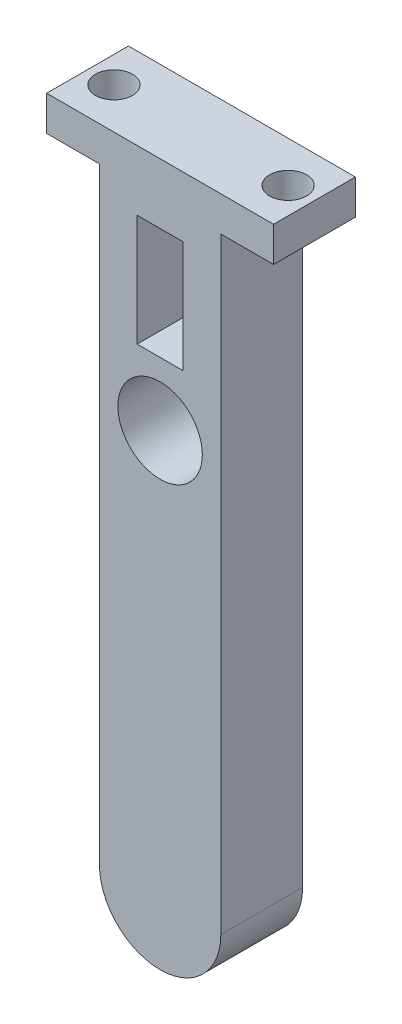
from build123d import *

# Parameters (mm, degrees)
ESTRUSIONE_ESTRUSIONE3_DEPTH = 15.5
SCHIZZO6_R                   = 8
TAGLIO_ESTRUSIONE1_DEPTH     = 15.5
SCHIZZO7_W                   = 8.7
SCHIZZO7_H                   = 21.146442976
TAGLIO_ESTRUSIONE2_DEPTH     = 15.5
SCHIZZO14_R                  = 3.5
TAGLIO_ESTRUSIONE3_DEPTH     = 6.6
SCHIZZO15_R                  = 3.5
TAGLIO_ESTRUSIONE4_DEPTH     = 6.6


with BuildPart() as part:
    # Schizzo3 → Estrusione-Estrusione3 (new body)
    with BuildSketch(Plane.XY):
        with BuildLine():
            Line((-62.60213075, -3.859058403), (-62.60213075, 111.140941597))
            Line((-62.60213075, 111.140941597), (-72.60213075, 111.140941597))
            Line((-72.60213075, 111.140941597), (-72.60213075, 117.740941597))
            Line((-72.60213075, 117.740941597), (-29.60213075, 117.740941597))
            Line((-29.60213075, 117.740941597), (-29.60213075, 111.140941597))
            Line((-29.60213075, 111.140941597), (-39.60213075, 111.140941597))
            Line((-39.60213075, 111.140941597), (-39.60213075, -3.859058403))
            ThreePointArc((-39.60213075, -3.859058403), (-51.10213075, -15.359058403), (-62.60213075, -3.859058403))
        make_face()
    extrude(amount=ESTRUSIONE_ESTRUSIONE3_DEPTH)

    # Schizzo6 → Taglio-Estrusione1 (cut)
    with BuildSketch(Plane.XY):
        with Locations((-51.10213075, 73.140941597)):
            Circle(SCHIZZO6_R)
    extrude(amount=TAGLIO_ESTRUSIONE1_DEPTH, mode=Mode.SUBTRACT)

    # Schizzo7 → Taglio-Estrusione2 (cut)
    with BuildSketch(Plane.XY):
        with Locations((-51.10213075, 95.714163085)):
            Rectangle(SCHIZZO7_W, SCHIZZO7_H)
    extrude(amount=TAGLIO_ESTRUSIONE2_DEPTH, mode=Mode.SUBTRACT)

    # Schizzo14 → Taglio-Estrusione3 (cut)
    with BuildSketch(Plane(origin=(0, 111.140941597, 0), x_dir=(-1, 0, 0), z_dir=(0, -1, 0))):
        with Locations(Location((34.60213075, -7.75, 0), (0, 0, 90))):
            Circle(SCHIZZO14_R)
    extrude(amount=-TAGLIO_ESTRUSIONE3_DEPTH, mode=Mode.SUBTRACT)

    # Schizzo15 → Taglio-Estrusione4 (cut)
    with BuildSketch(Plane(origin=(0, 111.140941597, 0), x_dir=(-1, 0, 0), z_dir=(0, -1, 0))):
        with Locations(Location((67.60213075, -7.75, 0), (0, 0, 90))):
            Circle(SCHIZZO15_R)
    extrude(amount=-TAGLIO_ESTRUSIONE4_DEPTH, mode=Mode.SUBTRACT)


solid = part.part
